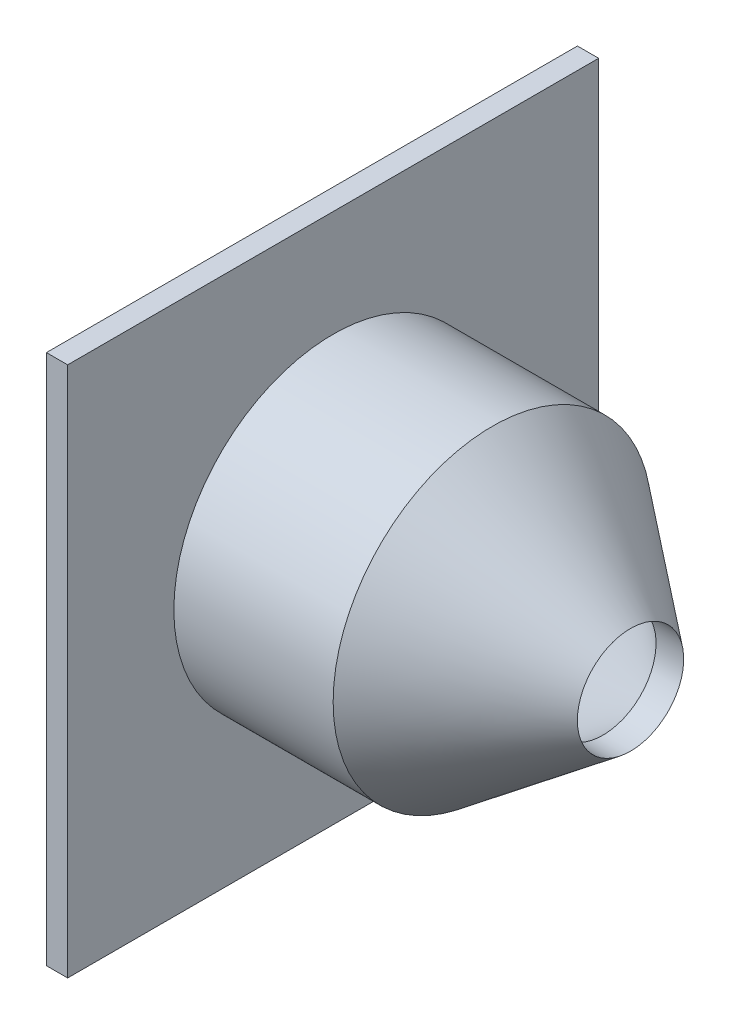
from build123d import *

# Parameters (mm, degrees)
SKETCH1_R           = 15
SKETCH1_R_2         = 13
BOSS_EXTRUDE1_DEPTH = 17
SKETCH1_4_W         = 50
SKETCH1_4_H         = 50
SKETCH1_4_R         = 15
BOSS_EXTRUDE2_DEPTH = 2


with BuildPart() as part:
    # Sketch1 → Boss-Extrude1 (new body)
    with BuildSketch(Plane(origin=(0, 0, 0), x_dir=(0, 0, -1), z_dir=(1, 0, 0))):
        Circle(SKETCH1_R)
        Circle(SKETCH1_R_2, mode=Mode.SUBTRACT)
    extrude(amount=BOSS_EXTRUDE1_DEPTH)

    # Sketch5 → Revolve1 (revolve)
    with BuildSketch(Plane(origin=(0, 0, 0), x_dir=(1, 0, 0), z_dir=(0, 1, 0))):
        Polygon((17, 15), (30, 5.00634506), (27.398349237, 5.00634506), (17, 13), align=None)
    revolve(axis=Axis((-1.32201978, 0, 0), (1, 0, 0)))


with BuildPart() as body_2:
    # Sketch1<4> → Boss-Extrude2 (new body)
    with BuildSketch(Plane(origin=(0, 0, 0), x_dir=(0, 0, -1), z_dir=(1, 0, 0))):
        Rectangle(SKETCH1_4_W, SKETCH1_4_H)
        Circle(SKETCH1_4_R, mode=Mode.SUBTRACT)
    extrude(amount=BOSS_EXTRUDE2_DEPTH)


solid = Compound([part.part, body_2.part])
